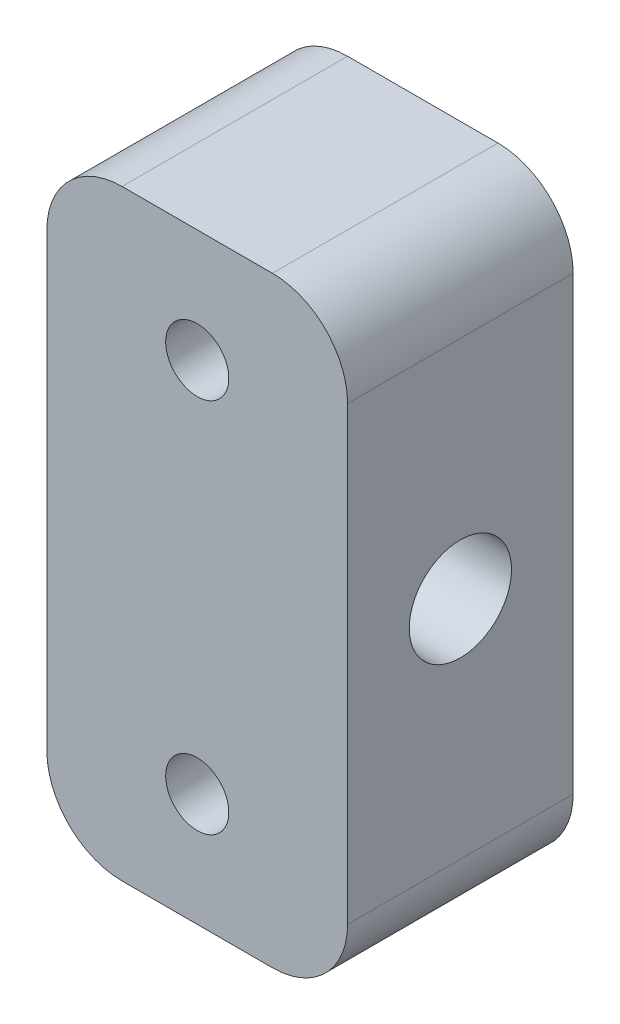
from build123d import *

# Parameters (mm, degrees)
IZIM1_W                     = 20
IZIM1_H                     = 40
Y_KSEKLIK_EKSTR_ZYON1_DEPTH = 7.5
RADYUS1_R                   = 5
M5_DI_LI_DELIK1_D           = 4.2
M8_DI_LI_DELIK1_D           = 6.8


with BuildPart() as part:
    # Çizim1 → Yükseklik-Ekstrüzyon1 (new, symmetric)
    with BuildSketch(Plane.XY):
        Rectangle(IZIM1_W, IZIM1_H)
    extrude(amount=Y_KSEKLIK_EKSTR_ZYON1_DEPTH, both=True)

    # Radyus1
    radyus1_edges = [part.edges().sort_by_distance(p)[0] for p in [
        (10, -20, 0),
        (-10, -20, 0),
        (-10, 20, 0),
        (10, 20, 0),
    ]]
    fillet(radyus1_edges, radius=RADYUS1_R)

    # M5 Dişli Delik1 (through all)
    with Locations(Plane(origin=(0, 12.5, -7.5), x_dir=(-1, 0, 0), z_dir=(0, 0, -1))):
        with Locations((0, 0), (0, -25)):
            Hole(M5_DI_LI_DELIK1_D / 2)

    # M8 Dişli Delik1 (through all)
    with Locations(Plane.ZY.offset(10)):
        with Locations((0, 0)):
            Hole(M8_DI_LI_DELIK1_D / 2)


solid = part.part
